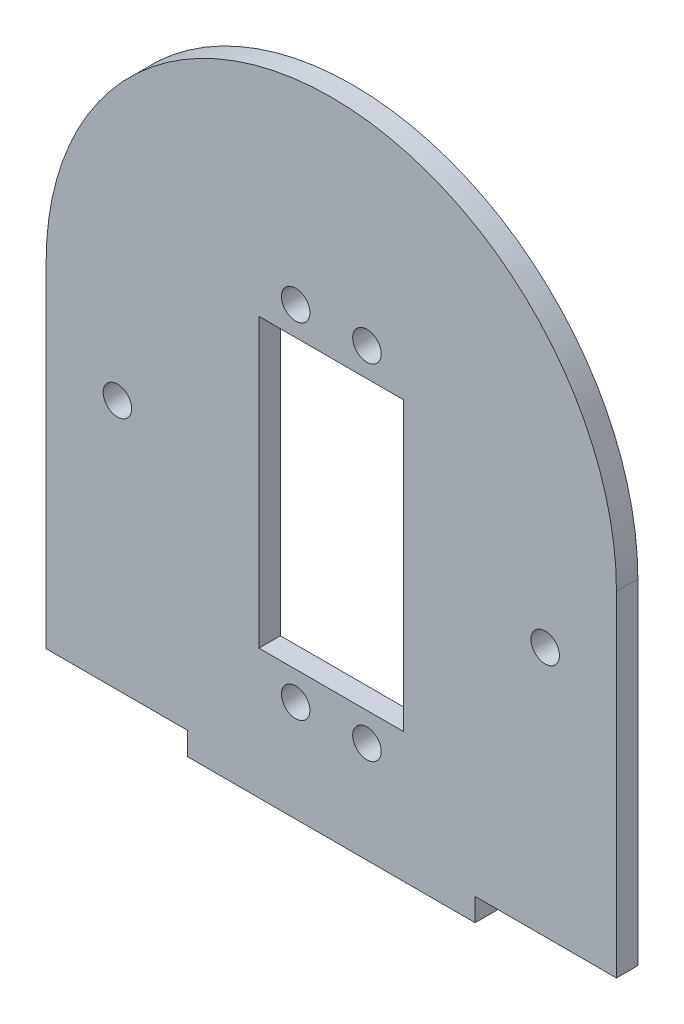
from build123d import *

# Parameters (mm, degrees)
CROQUIS1_R              = 2
CROQUIS1_W              = 20.3
CROQUIS1_H              = 40.3
SALIENTE_EXTRUIR1_DEPTH = 3


with BuildPart() as part:
    # Croquis1 → Saliente-Extruir1 (new body)
    with BuildSketch(Plane.XY):
        with BuildLine():
            Line((40, 0), (40, -47))
            Line((40, -47), (20.175, -47))
            Line((20.175, -47), (20.175, -50.2))
            Line((20.175, -50.2), (-20.175, -50.2))
            Line((-20.175, -50.2), (-20.175, -47))
            Line((-20.175, -47), (-40, -47))
            Line((-40, -47), (-40, 0))
            ThreePointArc((-40, 0), (-28.284271247, 28.284271247), (0, 40))
            ThreePointArc((0, 40), (28.284271247, 28.284271247), (40, 0))
        make_face()
        with Locations((-5, 12.3)):
            Circle(CROQUIS1_R, mode=Mode.SUBTRACT)
        with Locations(Location((5, 12.3, 0), (0, 0, 180))):
            Circle(CROQUIS1_R, mode=Mode.SUBTRACT)
        with Locations((5, -36)):
            Circle(CROQUIS1_R, mode=Mode.SUBTRACT)
        with Locations(Location((-5, -36, 0), (0, 0, 180))):
            Circle(CROQUIS1_R, mode=Mode.SUBTRACT)
        with Locations((-30, -11.85)):
            Circle(CROQUIS1_R, mode=Mode.SUBTRACT)
        with Locations(Location((30, -11.85, 0), (0, 0, 180))):
            Circle(CROQUIS1_R, mode=Mode.SUBTRACT)
        with Locations((0, -11.85)):
            Rectangle(CROQUIS1_W, CROQUIS1_H, mode=Mode.SUBTRACT)
    extrude(amount=SALIENTE_EXTRUIR1_DEPTH)


solid = part.part
